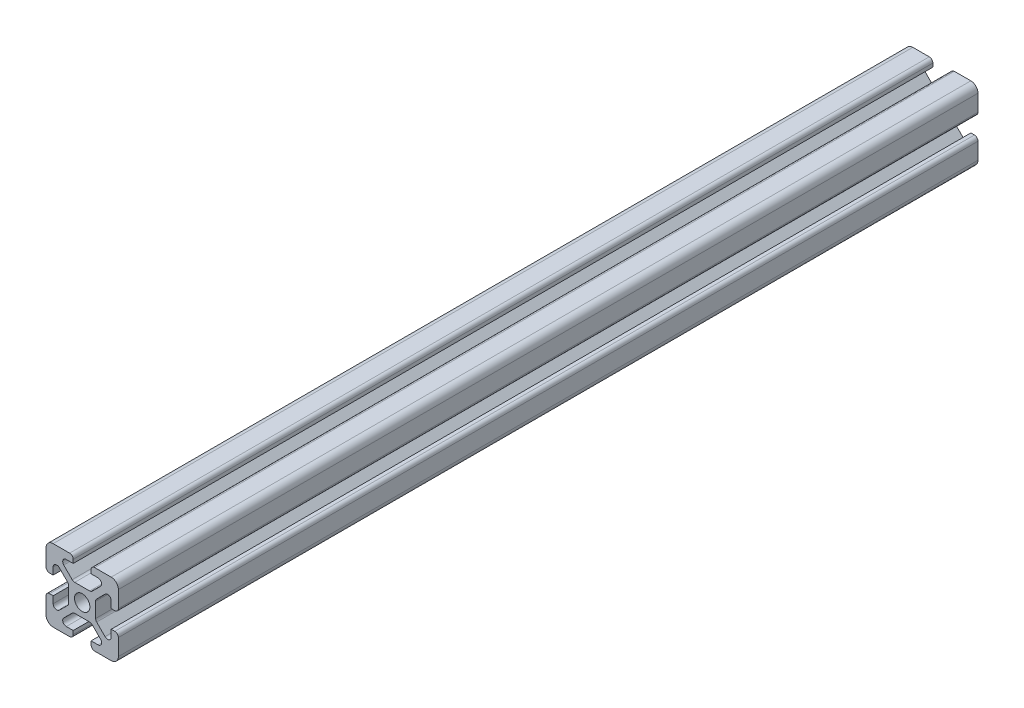
from build123d import *

# Parameters (mm, degrees)
SKETCH1_R           = 2.15
BOSS_EXTRUDE1_DEPTH = 240


with BuildPart() as part:
    # Sketch1 → Boss-Extrude1 (new body)
    with BuildSketch(Plane.XY):
        with BuildLine():
            Line((2, 0), (6.6, 0))
            ThreePointArc((6.6, 0), (7.307106781, 0.292893219), (7.6, 1))
            Line((7.6, 1), (7.6, 2))
            Line((7.6, 2), (5.664213562, 2))
            ThreePointArc((5.664213562, 2), (4.74033403, 2.617316568), (4.957106781, 3.707106781))
            Line((4.957106781, 3.707106781), (7.307106781, 6.057106781))
            ThreePointArc((7.307106781, 6.057106781), (7.63153013, 6.273879533), (8.014213562, 6.35))
            Line((8.014213562, 6.35), (12.185786438, 6.35))
            ThreePointArc((12.185786438, 6.35), (12.56846987, 6.273879533), (12.892893219, 6.057106781))
            Line((12.892893219, 6.057106781), (15.242893219, 3.707106781))
            ThreePointArc((15.242893219, 3.707106781), (15.45966597, 2.617316568), (14.535786438, 2))
            Line((14.535786438, 2), (12.6, 2))
            Line((12.6, 2), (12.6, 1))
            ThreePointArc((12.6, 1), (12.892893219, 0.292893219), (13.6, 0))
            Line((13.6, 0), (18.2, 0))
            ThreePointArc((18.2, 0), (19.614213562, 0.585786438), (20.2, 2))
            Line((20.2, 2), (20.2, 6.6))
            ThreePointArc((20.2, 6.6), (19.907106781, 7.307106781), (19.2, 7.6))
            Line((19.2, 7.6), (18.2, 7.6))
            Line((18.2, 7.6), (18.2, 5.664213562))
            ThreePointArc((18.2, 5.664213562), (17.582683432, 4.74033403), (16.492893219, 4.957106781))
            Line((16.492893219, 4.957106781), (14.142893219, 7.307106781))
            ThreePointArc((14.142893219, 7.307106781), (13.926120467, 7.63153013), (13.85, 8.014213562))
            Line((13.85, 8.014213562), (13.85, 12.185786438))
            ThreePointArc((13.85, 12.185786438), (13.926120467, 12.56846987), (14.142893219, 12.892893219))
            Line((14.142893219, 12.892893219), (16.492893219, 15.242893219))
            ThreePointArc((16.492893219, 15.242893219), (17.582683432, 15.45966597), (18.2, 14.535786438))
            Line((18.2, 14.535786438), (18.2, 12.6))
            Line((18.2, 12.6), (19.2, 12.6))
            ThreePointArc((19.2, 12.6), (19.907106781, 12.892893219), (20.2, 13.6))
            Line((20.2, 13.6), (20.2, 18.2))
            ThreePointArc((20.2, 18.2), (19.614213562, 19.614213562), (18.2, 20.2))
            Line((18.2, 20.2), (13.6, 20.2))
            ThreePointArc((13.6, 20.2), (12.892893219, 19.907106781), (12.6, 19.2))
            Line((12.6, 19.2), (12.6, 18.2))
            Line((12.6, 18.2), (14.535786438, 18.2))
            ThreePointArc((14.535786438, 18.2), (15.45966597, 17.582683432), (15.242893219, 16.492893219))
            Line((15.242893219, 16.492893219), (12.892893219, 14.142893219))
            ThreePointArc((12.892893219, 14.142893219), (12.56846987, 13.926120467), (12.185786438, 13.85))
            Line((12.185786438, 13.85), (8.014213562, 13.85))
            ThreePointArc((8.014213562, 13.85), (7.63153013, 13.926120467), (7.307106781, 14.142893219))
            Line((7.307106781, 14.142893219), (4.957106781, 16.492893219))
            ThreePointArc((4.957106781, 16.492893219), (4.74033403, 17.582683432), (5.664213562, 18.2))
            Line((5.664213562, 18.2), (7.6, 18.2))
            Line((7.6, 18.2), (7.6, 19.2))
            ThreePointArc((7.6, 19.2), (7.307106781, 19.907106781), (6.6, 20.2))
            Line((6.6, 20.2), (2, 20.2))
            ThreePointArc((2, 20.2), (0.585786438, 19.614213562), (0, 18.2))
            Line((0, 18.2), (0, 13.6))
            ThreePointArc((0, 13.6), (0.292893219, 12.892893219), (1, 12.6))
            Line((1, 12.6), (2, 12.6))
            Line((2, 12.6), (2, 14.535786438))
            ThreePointArc((2, 14.535786438), (2.617316568, 15.45966597), (3.707106781, 15.242893219))
            Line((3.707106781, 15.242893219), (6.057106781, 12.892893219))
            ThreePointArc((6.057106781, 12.892893219), (6.273879533, 12.56846987), (6.35, 12.185786438))
            Line((6.35, 12.185786438), (6.35, 8.014213562))
            ThreePointArc((6.35, 8.014213562), (6.273879533, 7.63153013), (6.057106781, 7.307106781))
            Line((6.057106781, 7.307106781), (3.707106781, 4.957106781))
            ThreePointArc((3.707106781, 4.957106781), (2.617316568, 4.74033403), (2, 5.664213562))
            Line((2, 5.664213562), (2, 7.6))
            Line((2, 7.6), (1, 7.6))
            ThreePointArc((1, 7.6), (0.292893219, 7.307106781), (0, 6.6))
            Line((0, 6.6), (0, 2))
            ThreePointArc((0, 2), (0.585786438, 0.585786438), (2, 0))
        make_face()
        with Locations((10.1, 10)):
            Circle(SKETCH1_R, mode=Mode.SUBTRACT)
    extrude(amount=BOSS_EXTRUDE1_DEPTH)


solid = part.part
